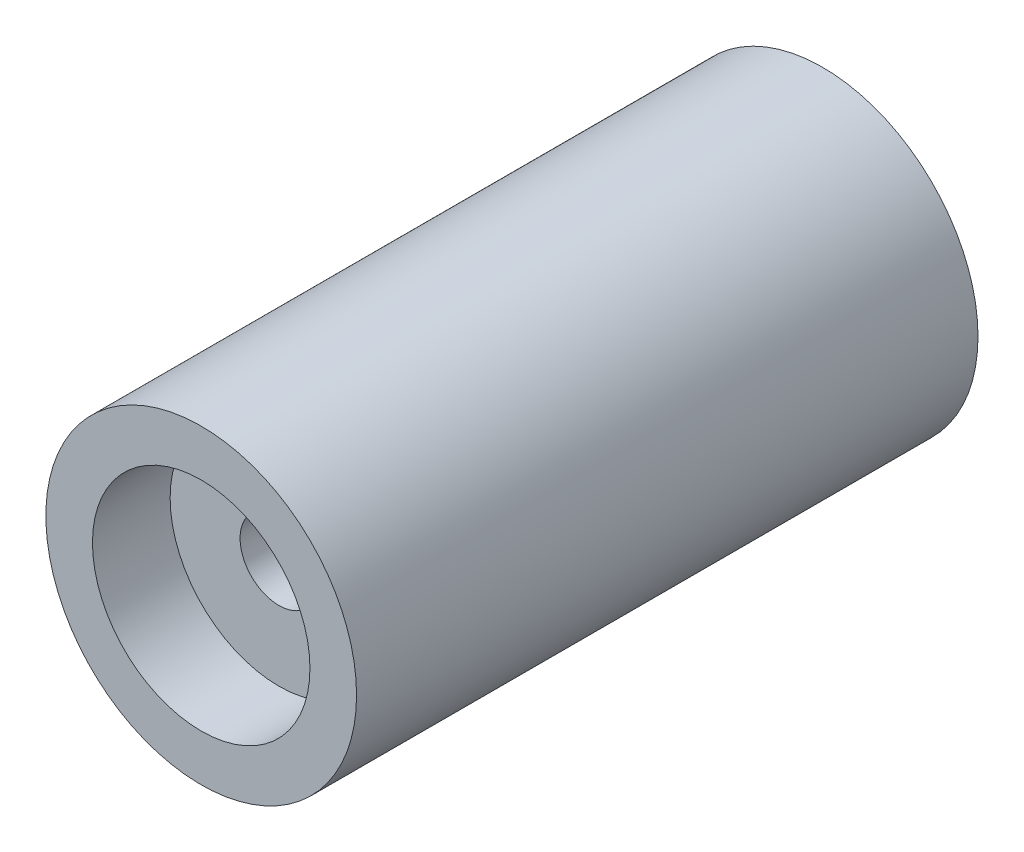
from build123d import *

# Parameters (mm, degrees)
SKETCH_1_R          = 10
SKETCH_1_R_2        = 2.5
EXTRUDE_1_DEPTH     = 40
SKETCH_2_R          = 7
CUT_EXTRUDE_1_DEPTH = 5


with BuildPart() as part:
    # 草图1 → 凸台-拉伸1 (new body)
    with BuildSketch(Plane.XY):
        Circle(SKETCH_1_R)
        Circle(SKETCH_1_R_2, mode=Mode.SUBTRACT)
    extrude(amount=EXTRUDE_1_DEPTH)

    # 草图2 → 切除-拉伸1 (cut)
    with BuildSketch(Plane(origin=(0, 0, 0), x_dir=(-1, 0, 0), z_dir=(0, 0, -1))):
        Circle(SKETCH_2_R)
    cut_extrude_1 = extrude(amount=-CUT_EXTRUDE_1_DEPTH, mode=Mode.SUBTRACT)

    # 镜向1: 切除-拉伸1 across plane
    add(cut_extrude_1.mirror(Plane.XY.offset(20)), mode=Mode.SUBTRACT)


solid = part.part
